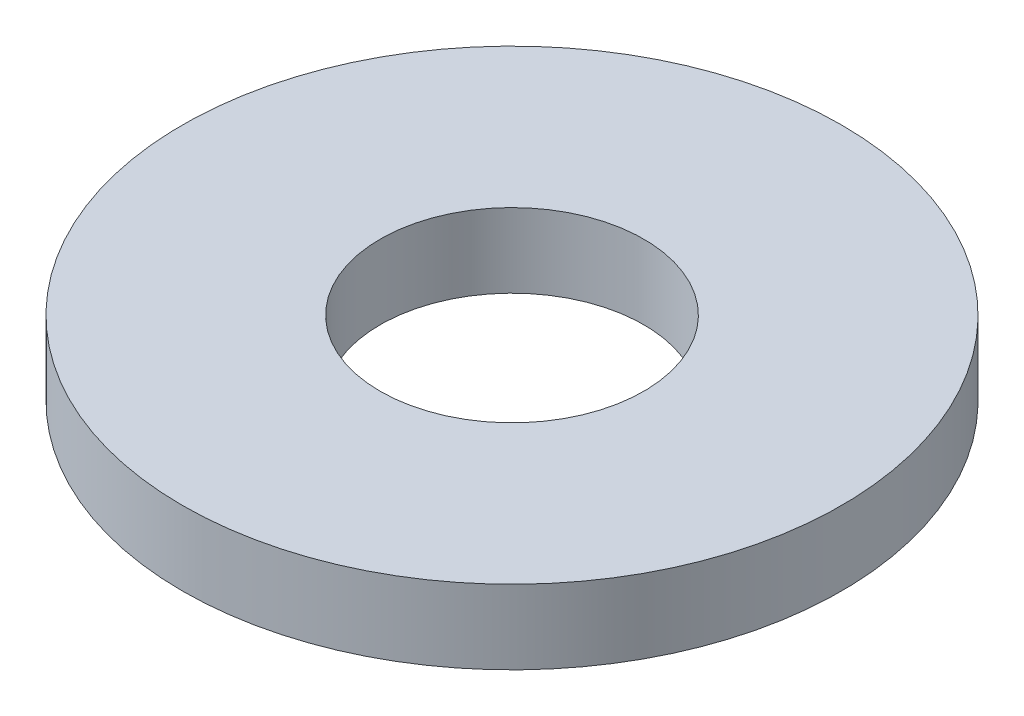
from build123d import *

# Parameters (mm, degrees)
SKETCH1_R           = 4
BOSS_EXTRUDE1_DEPTH = 0.9
SKETCH5_R           = 1.6
CUT_EXTRUDE1_DEPTH  = 6.728001397


with BuildPart() as part:
    # Sketch1 → Boss-Extrude1 (new body)
    with BuildSketch(Plane(origin=(0, 0, 0), x_dir=(1, 0, 0), z_dir=(0, 1, 0))):
        with Locations(Location((0, 0, 0), (0, 0, 270))):
            Circle(SKETCH1_R)
    extrude(amount=BOSS_EXTRUDE1_DEPTH)

    # Sketch5 → Cut-Extrude1 (cut, through all)
    with BuildSketch(Plane(origin=(0, 0.9, 0), x_dir=(-1, 0, 0), z_dir=(0, 1, 0))):
        with Locations(Location((0, 0, 0), (0, 0, 90))):
            Circle(SKETCH5_R)
    extrude(amount=-CUT_EXTRUDE1_DEPTH, mode=Mode.SUBTRACT)


solid = part.part
